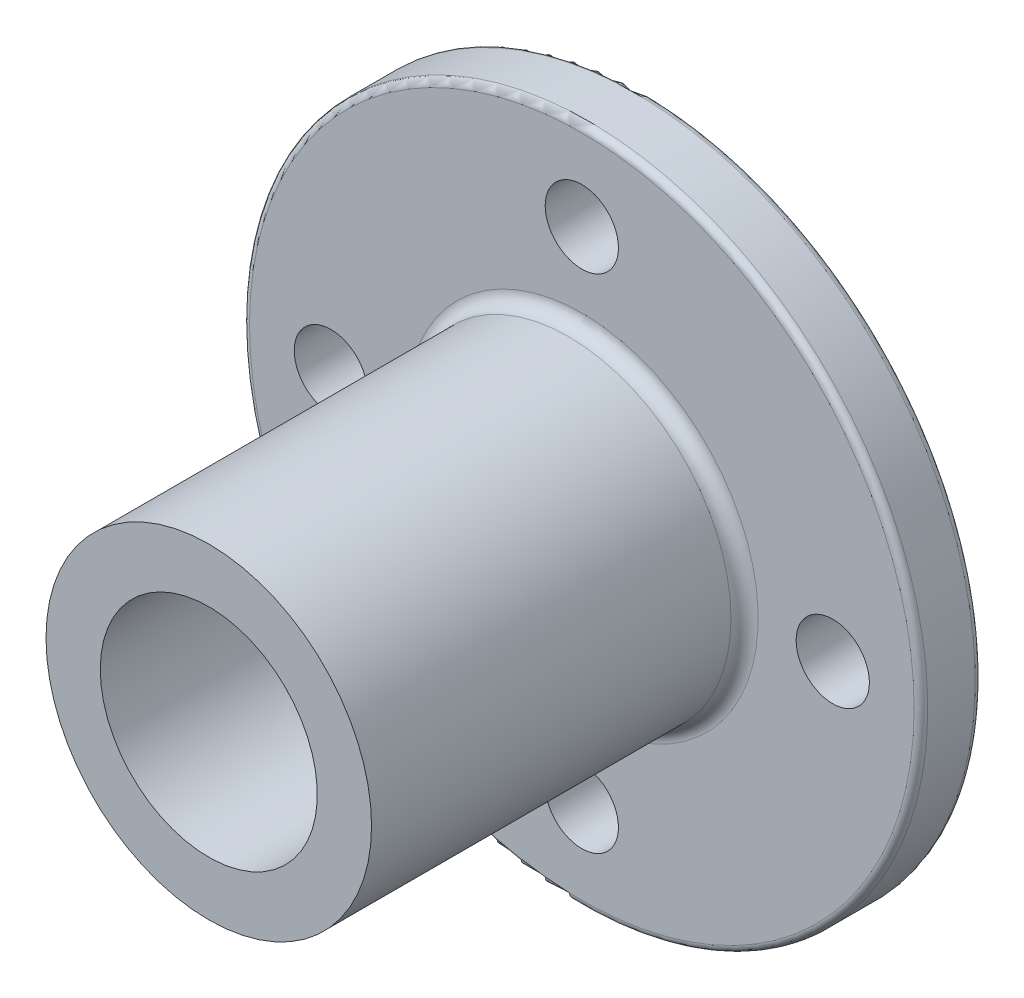
from build123d import *

# Parameters (mm, degrees)
CUT_EXTRUDE1_DEPTH      = 48.68647607
CUT_EXTRUDE1_DEPTH_BACK = 48.68647607
SKETCH2_R               = 2.7


with BuildPart() as part:
    # Sketch1 → Revolve1 (revolve)
    with BuildSketch(Plane(origin=(0, 0, 0), x_dir=(0, 0, -1), z_dir=(1, 0, 0)), mode=Mode.PRIVATE) as revolve1_sk:
        with BuildLine():
            Line((-16, 8), (16, 8))
            Line((16, 8), (16, 24.5))
            ThreePointArc((16, 24.5), (15.853553391, 24.853553391), (15.5, 25))
            Line((15.5, 25), (12, 25))
            ThreePointArc((12, 25), (11.646446609, 24.853553391), (11.5, 24.5))
            Line((11.5, 24.5), (11.5, 13))
            ThreePointArc((11.5, 13), (11.207106781, 12.292893219), (10.5, 12))
            Line((10.5, 12), (-16, 12))
            Line((-16, 12), (-16, 8))
        make_face()
    revolve(revolve1_sk.sketch.rotate(Axis((0, 0, 0), (0, 0, 1)), 90), axis=Axis((0, 0, 0), (0, 0, 1)))

    # Sketch2 → Cut-Extrude1 (cut, two sides: drawn at the far end of the back side and taken through both)
    with BuildSketch(Plane(origin=(0, 0, -16), x_dir=(-1, 0, 0), z_dir=(0, 0, -1)).offset(-CUT_EXTRUDE1_DEPTH_BACK)):
        with Locations((0, 18.5)):
            Circle(SKETCH2_R)
        with Locations((18.5, 0)):
            Circle(SKETCH2_R)
        with Locations((0, -18.5)):
            Circle(SKETCH2_R)
        with Locations((-18.5, 0)):
            Circle(SKETCH2_R)
    extrude(amount=CUT_EXTRUDE1_DEPTH + CUT_EXTRUDE1_DEPTH_BACK, mode=Mode.SUBTRACT)


solid = part.part
